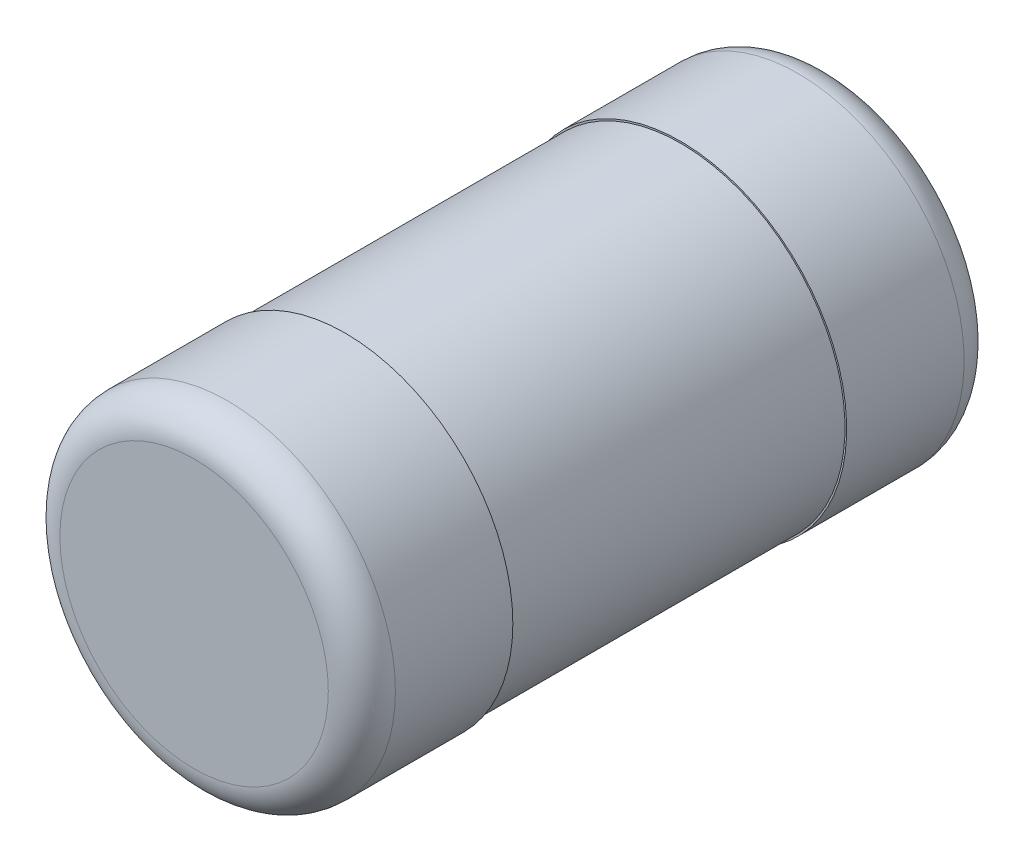
from build123d import *

# Parameters (mm, degrees)
SKETCH_1_R      = 2.45
EXTRUDE_1_DEPTH = 5
SKETCH_2_R      = 2.5
EXTRUDE_2_DEPTH = 2.25
SKETCH_3_R      = 2.475
EXTRUDE_3_DEPTH = 2.25
FILLET_1_R      = 0.5


with BuildPart() as part:
    # 스케치1 → 보스-돌출1 (new body)
    with BuildSketch(Plane.XY):
        Circle(SKETCH_1_R)
    extrude(amount=EXTRUDE_1_DEPTH)

    # 스케치2 → 보스-돌출2 (add)
    with BuildSketch(Plane.XY.offset(5)):
        Circle(SKETCH_2_R)
    extrude(amount=EXTRUDE_2_DEPTH)

    # 스케치3 → 보스-돌출3 (add)
    with BuildSketch(Plane(origin=(0, 0, 0), x_dir=(-1, 0, 0), z_dir=(0, 0, -1))):
        Circle(SKETCH_3_R)
    extrude(amount=EXTRUDE_3_DEPTH)

    # 필렛1
    fillet_1_edges = [part.edges().sort_by_distance(p)[0] for p in [
        (-2.5, 0, 7.25),
        (2.475, 0, -2.25),
    ]]
    fillet(fillet_1_edges, radius=FILLET_1_R)


solid = part.part
